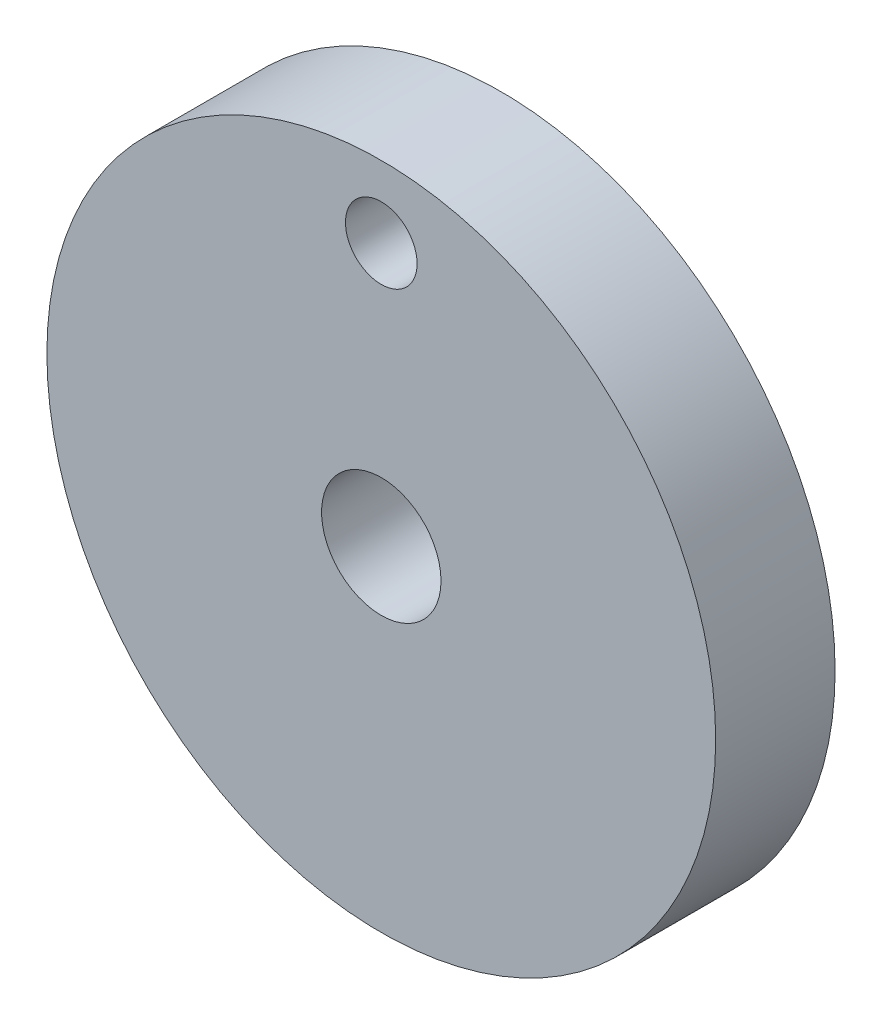
from build123d import *

# Parameters (mm, degrees)
SKETCH1_R           = 14
BOSS_EXTRUDE1_DEPTH = 5
SKETCH2_R           = 1.5
SKETCH2_R_2         = 2.5
CUT_EXTRUDE1_DEPTH  = 21.420577857


with BuildPart() as part:
    # Sketch1 → Boss-Extrude1 (new body)
    with BuildSketch(Plane.XY):
        Circle(SKETCH1_R)
    extrude(amount=BOSS_EXTRUDE1_DEPTH)

    # Sketch2 → Cut-Extrude1 (cut, through all)
    with BuildSketch(Plane.XY):
        with Locations((0, 11)):
            Circle(SKETCH2_R)
        Circle(SKETCH2_R_2)
    extrude(amount=CUT_EXTRUDE1_DEPTH, mode=Mode.SUBTRACT)


solid = part.part
